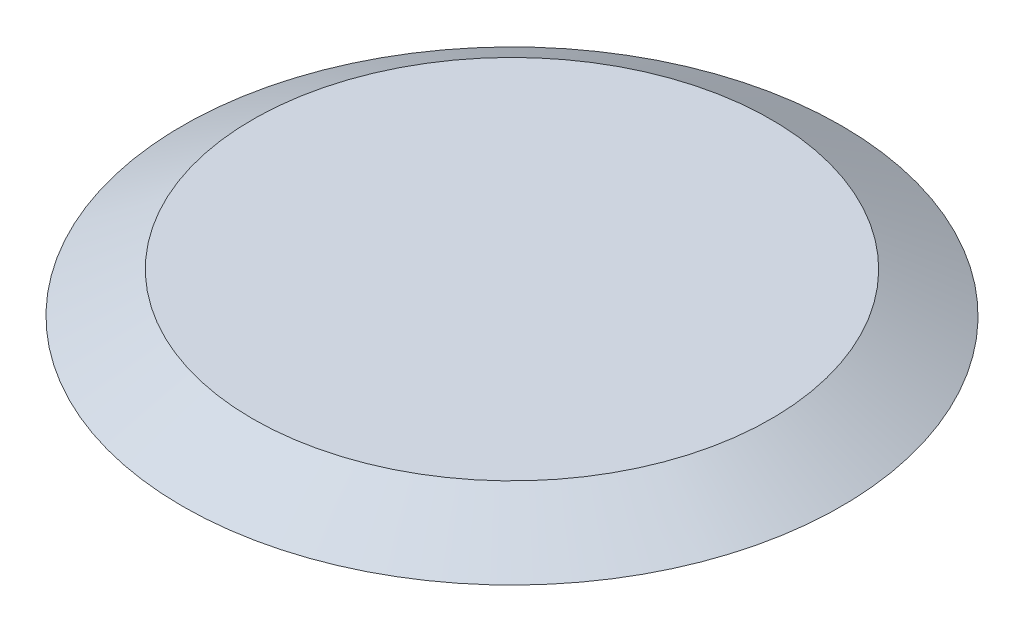
from build123d import *

# Parameters (mm, degrees)
SKETCH1_R           = 8.255
BOSS_EXTRUDE1_DEPTH = 1.016
BOSS_EXTRUDE1_TAPER = 60


with BuildPart() as part:
    # Sketch1 → Boss-Extrude1 (new body)
    with BuildSketch(Plane(origin=(0, 0, 0), x_dir=(1, 0, 0), z_dir=(0, 1, 0))):
        Circle(SKETCH1_R)
    extrude(amount=BOSS_EXTRUDE1_DEPTH, taper=BOSS_EXTRUDE1_TAPER)


solid = part.part
